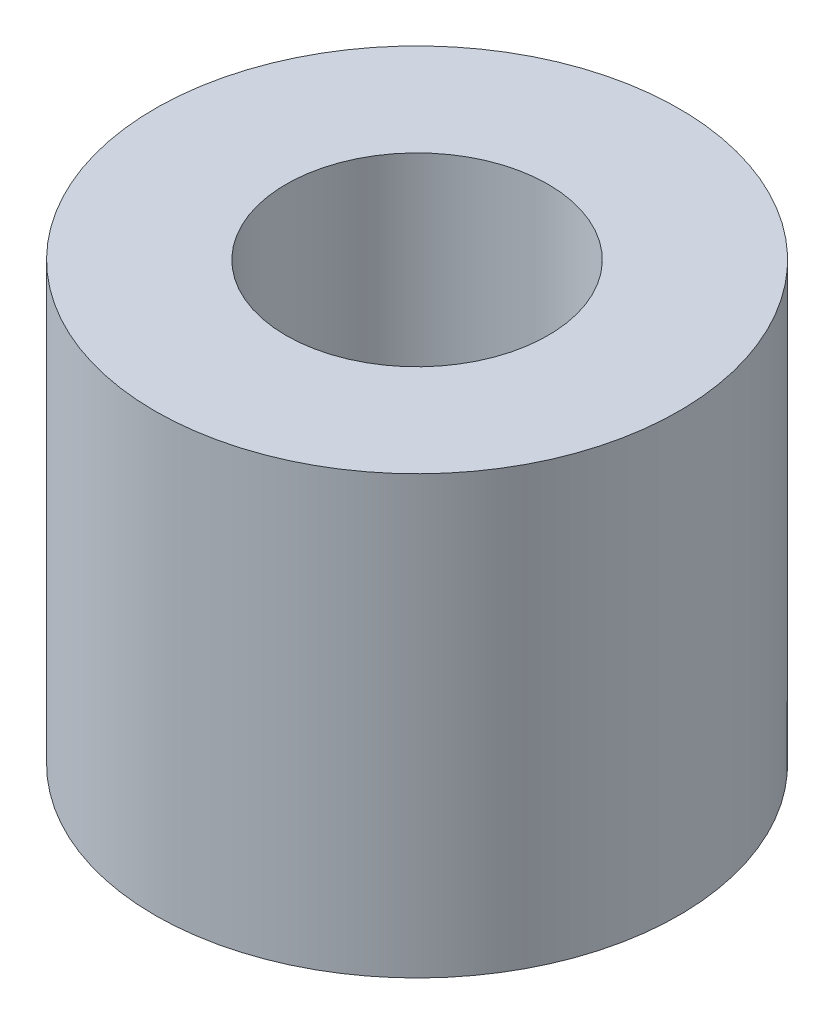
from build123d import *

# Parameters (mm, degrees)
SKETCH1_R           = 3
SKETCH1_R_2         = 1.5
BOSS_EXTRUDE1_DEPTH = 5


with BuildPart() as part:
    # Sketch1 → Boss-Extrude1 (new body)
    with BuildSketch(Plane(origin=(0, 0, 0), x_dir=(1, 0, 0), z_dir=(0, 1, 0))):
        with Locations(Location((0, 0, 0), (0, 0, 270))):
            Circle(SKETCH1_R)
        with Locations(Location((0, 0, 0), (0, 0, 270))):
            Circle(SKETCH1_R_2, mode=Mode.SUBTRACT)
    extrude(amount=BOSS_EXTRUDE1_DEPTH)


solid = part.part
